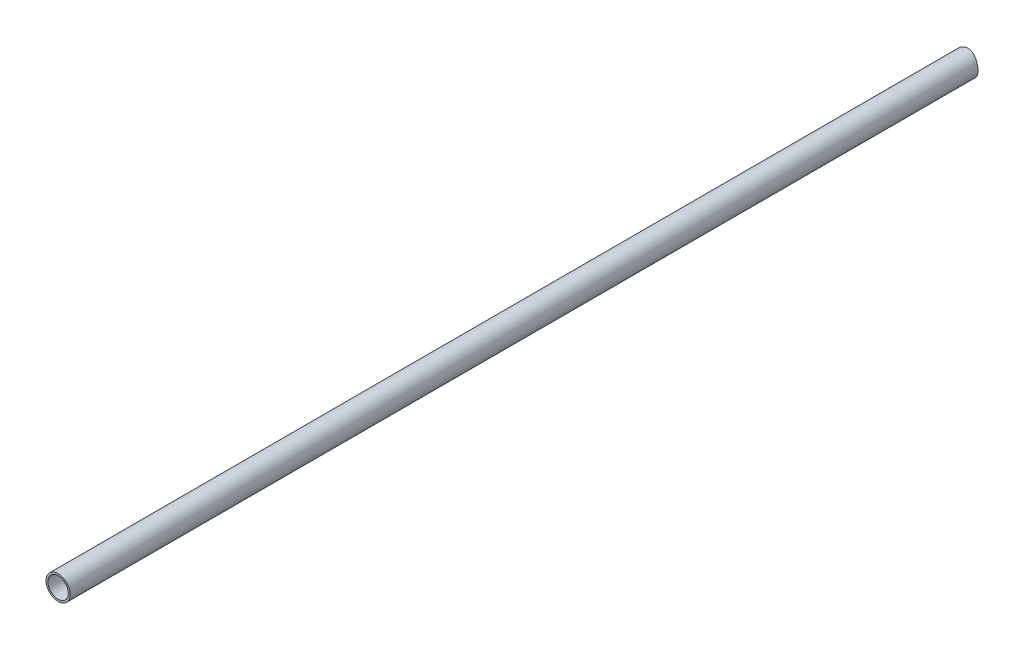
from build123d import *

# Parameters (mm, degrees)
SKETCH1_R               = 13.35
SKETCH1_R_2             = 11.24
BOSS_EXTRUDE1_DEPTH     = 1100
CUT_EXTRUDE1_DEPTH      = 1101.162008524
CUT_EXTRUDE1_DEPTH_BACK = 1101.162008524
SKETCH2_R               = 40
CUT_EXTRUDE2_DEPTH      = 1101.162008627
CUT_EXTRUDE2_DEPTH_BACK = 1101.162008627
SKETCH3_R               = 2231.362480005
SKETCH3_R_2             = 1042


with BuildPart() as part:
    # Sketch1 → Boss-Extrude1 (new body)
    with BuildSketch(Plane.XY):
        Circle(SKETCH1_R)
        Circle(SKETCH1_R_2, mode=Mode.SUBTRACT)
    extrude(amount=BOSS_EXTRUDE1_DEPTH)

    # Sketch2 → Cut-Extrude1 (cut, two sides: drawn at the far end of the back side and taken through both)
    with BuildSketch(Plane(origin=(0, 0, 0), x_dir=(0, 0, -1), z_dir=(1, 0, 0)).offset(-CUT_EXTRUDE1_DEPTH_BACK)):
        Circle(SKETCH2_R)
    extrude(amount=CUT_EXTRUDE1_DEPTH + CUT_EXTRUDE1_DEPTH_BACK, mode=Mode.SUBTRACT)

    # Sketch3 → Cut-Extrude2 (cut, two sides: drawn at the far end of the back side and taken through both)
    with BuildSketch(Plane(origin=(0, 0, 0), x_dir=(0, 0, -1), z_dir=(1, 0, 0)).offset(-CUT_EXTRUDE2_DEPTH_BACK)):
        Circle(SKETCH3_R)
        Circle(SKETCH3_R_2, mode=Mode.SUBTRACT)
    extrude(amount=CUT_EXTRUDE2_DEPTH + CUT_EXTRUDE2_DEPTH_BACK, mode=Mode.SUBTRACT)


solid = part.part
